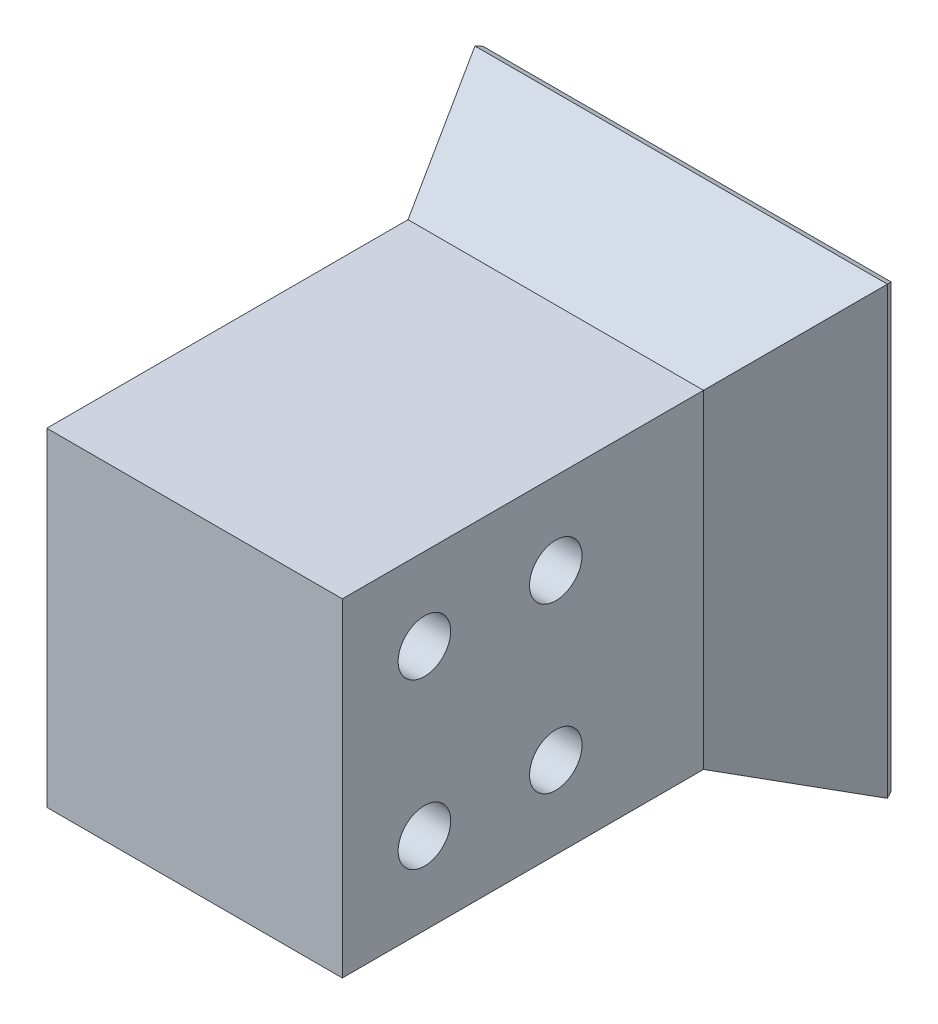
from build123d import *
from OCP.BRepFilletAPI import BRepFilletAPI_MakeChamfer

# Parameters (mm, degrees)
SKETCH2_W           = 18
SKETCH2_H           = 20
BOSS_EXTRUDE1_DEPTH = 22
SKETCH3_W           = 18
SKETCH3_H           = 20
BOSS_EXTRUDE2_DEPTH = 8
BOSS_EXTRUDE2_DRAFT = -25
SKETCH4_R           = 1.6
CUT_EXTRUDE1_DEPTH  = 18
CHAMFER1_SIZE       = 0.4
CHAMFER1_SIZE2      = 0.300994928


with BuildPart() as part:
    # Sketch2 → Boss-Extrude1 (new body)
    with BuildSketch(Plane.XY):
        Rectangle(SKETCH2_W, SKETCH2_H)
    extrude(amount=BOSS_EXTRUDE1_DEPTH)


with BuildPart() as boss_extrude2_tool:
    # Sketch3 → Boss-Extrude2 (with draft: the straight prism first)
    with BuildSketch(Plane(origin=(0, 0, 0), x_dir=(-1, 0, 0), z_dir=(0, 0, -1))):
        Rectangle(SKETCH3_W, SKETCH3_H)
    extrude(amount=BOSS_EXTRUDE2_DEPTH)
    # Boss-Extrude2: the draft: its side faces are tilted about the plane it starts from
    boss_extrude2_sides = [boss_extrude2_tool.faces().sort_by_distance(p)[0] for p in [
        (9, 0, -4),
        (0, -10, -4),
        (-9, 0, -4),
        (0, 10, -4),
    ]]
    draft(boss_extrude2_sides, Plane(origin=(0, 0, 0), x_dir=(-1, 0, 0), z_dir=(0, 0, -1)), BOSS_EXTRUDE2_DRAFT)


with BuildPart() as part_1:
    add(part.part)

    # Boss-Extrude2: add boss_extrude2_tool
    add(boss_extrude2_tool.part)

    # Sketch4 → Cut-Extrude1 (cut)
    with BuildSketch(Plane(origin=(9, 0, 0), x_dir=(0, 0, -1), z_dir=(1, 0, 0))):
        with Locations((-17, 5)):
            Circle(SKETCH4_R)
        with Locations((-9, 5)):
            Circle(SKETCH4_R)
        with Locations((-17, -5)):
            Circle(SKETCH4_R)
        with Locations((-9, -5)):
            Circle(SKETCH4_R)
    extrude(amount=-CUT_EXTRUDE1_DEPTH, mode=Mode.SUBTRACT)

    # Chamfer1: one chamfer whose edges measure the first distance from different faces: ONE call of the kernel's chamfer builder (chamfer() names one face for all edges)
    chamfer1_edges_1 = [part_1.edges().sort_by_distance(p)[0] for p in [
        (0, 13.730461265, -8),
    ]]
    chamfer1_side_1 = [part_1.faces().sort_by_distance(p)[0] for p in [
        (0, 11.971965146, -4.228892903),
    ]]
    chamfer1_edges_2 = [part_1.edges().sort_by_distance(p)[0] for p in [
        (12.730461265, 0, -8),
    ]]
    chamfer1_side_2 = [part_1.faces().sort_by_distance(p)[0] for p in [
        (10.962969576, 0, -4.20960184),
    ]]
    chamfer1_edges_3 = [part_1.edges().sort_by_distance(p)[0] for p in [
        (0, -13.730461265, -8),
    ]]
    chamfer1_side_3 = [part_1.faces().sort_by_distance(p)[0] for p in [
        (0, -11.971965146, -4.228892903),
    ]]
    chamfer1_edges_4 = [part_1.edges().sort_by_distance(p)[0] for p in [
        (-12.730461265, 0, -8),
    ]]
    chamfer1_side_4 = [part_1.faces().sort_by_distance(p)[0] for p in [
        (-10.962969576, 0, -4.20960184),
    ]]
    chamfer1 = BRepFilletAPI_MakeChamfer(part_1.part.solid().wrapped)
    for e in chamfer1_edges_1:
        chamfer1.Add(CHAMFER1_SIZE, CHAMFER1_SIZE2, e.wrapped, chamfer1_side_1[0].wrapped)  # the first distance lies on this face
    for e in chamfer1_edges_2:
        chamfer1.Add(CHAMFER1_SIZE, CHAMFER1_SIZE2, e.wrapped, chamfer1_side_2[0].wrapped)  # the first distance lies on this face
    for e in chamfer1_edges_3:
        chamfer1.Add(CHAMFER1_SIZE, CHAMFER1_SIZE2, e.wrapped, chamfer1_side_3[0].wrapped)  # the first distance lies on this face
    for e in chamfer1_edges_4:
        chamfer1.Add(CHAMFER1_SIZE, CHAMFER1_SIZE2, e.wrapped, chamfer1_side_4[0].wrapped)  # the first distance lies on this face
    add(Compound.cast(chamfer1.Shape()), mode=Mode.REPLACE)


solid = part_1.part
